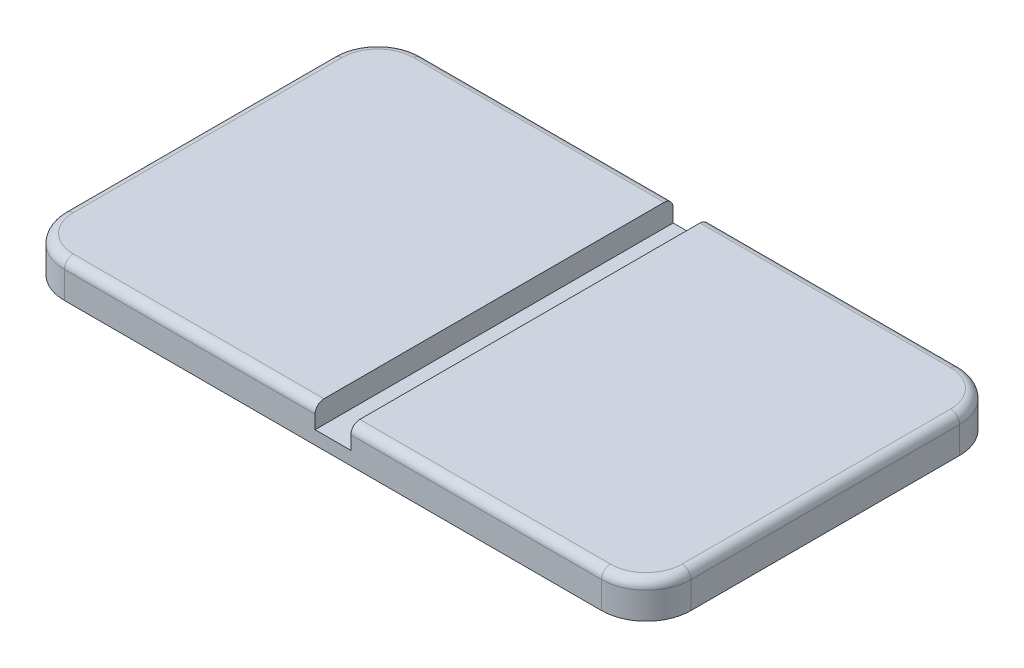
from build123d import *

# Parameters (mm, degrees)
SKETCH1_W           = 8
SKETCH1_H           = 80
BOSS_EXTRUDE1_DEPTH = 3
BOSS_EXTRUDE2_DEPTH = 8
FILLET1_R           = 2


with BuildPart() as part:
    # Sketch1 → Boss-Extrude1 (new body)
    with BuildSketch(Plane(origin=(0, 0, 0), x_dir=(1, 0, 0), z_dir=(0, 1, 0))):
        Rectangle(SKETCH1_W, SKETCH1_H)
    extrude(amount=BOSS_EXTRUDE1_DEPTH)

    # Sketch1<3> → Boss-Extrude2 (add)
    with BuildSketch(Plane(origin=(0, 0, 0), x_dir=(1, 0, 0), z_dir=(0, 1, 0))):
        with BuildLine():
            ThreePointArc((-70, -30), (-67.071067812, -37.071067812), (-60, -40))
            Line((-60, -40), (-4, -40))
            Line((-4, -40), (-4, 40))
            Line((-4, 40), (-60, 40))
            ThreePointArc((-60, 40), (-67.071067812, 37.071067812), (-70, 30))
            Line((-70, 30), (-70, -30))
        make_face()
        with BuildLine():
            Line((4, 40), (4, -40))
            Line((4, -40), (60, -40))
            ThreePointArc((60, -40), (67.071067812, -37.071067812), (70, -30))
            Line((70, -30), (70, 30))
            ThreePointArc((70, 30), (67.071067812, 37.071067812), (60, 40))
            Line((60, 40), (4, 40))
        make_face()
    extrude(amount=BOSS_EXTRUDE2_DEPTH)

    # Fillet1
    fillet1_edges = [part.edges().sort_by_distance(p)[0] for p in [
        (-32, 8, 40),
        (-67.071067812, 8, 37.071067812),
        (-32, 8, -40),
        (-67.071067812, 8, -37.071067812),
        (32, 8, 40),
        (32, 8, -40),
        (67.071067812, 8, -37.071067812),
        (70, 8, 0),
        (67.071067812, 8, 37.071067812),
        (-70, 8, 0),
    ]]
    fillet(fillet1_edges, radius=FILLET1_R)


solid = part.part
